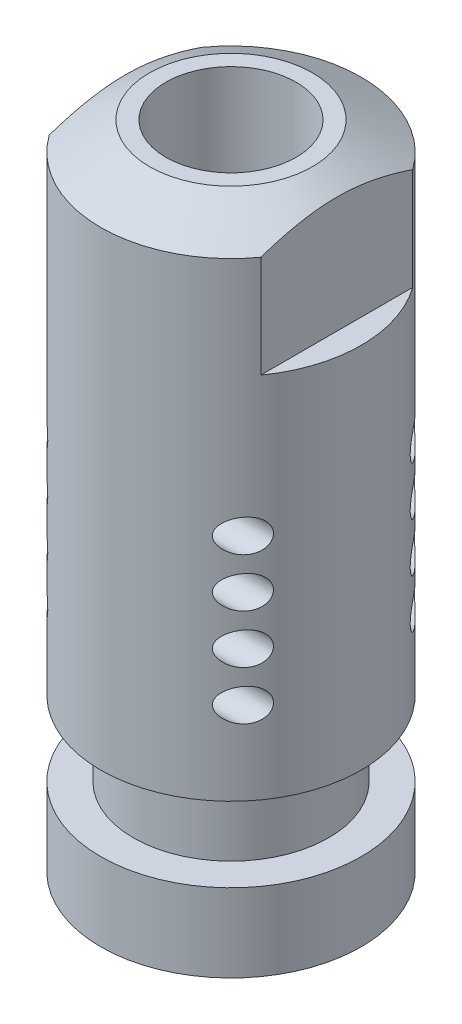
from build123d import *

# Parameters (mm, degrees)
SKETCH_1_R               = 8
EXTRUDE_1_DEPTH          = 40
CUT_EXTRUDE_START        = 4.8
SKETCH_1_3_R             = 8
SKETCH_1_3_R_2           = 6
CUT_EXTRUDE_1_DEPTH      = 4.6
CUT_EXTRUDE_START_2      = -8
CUT_EXTRUDE_2_DEPTH      = 8
SKETCH_4_3_R             = 4
CUT_EXTRUDE_3_DEPTH      = 11.5
CUT_EXTRUDE_4_DEPTH      = 42.569219382
CUT_EXTRUDE_4_DEPTH_BACK = 42.569219382
SKETCH_5_R               = 1
SKETCH_6_R               = 3.25
CUT_EXTRUDE_5_DEPTH      = 7.5


with BuildPart() as part:
    # 스케치1 → 보스-돌출1 (new body)
    with BuildSketch(Plane(origin=(0, 0, 0), x_dir=(1, 0, 0), z_dir=(0, 1, 0))):
        Circle(SKETCH_1_R)
    extrude(amount=EXTRUDE_1_DEPTH)

    # 스케치1<3> → 컷-돌출1 (cut)
    with BuildSketch(Plane(origin=(0, 0, 0), x_dir=(1, 0, 0), z_dir=(0, 1, 0)).offset(CUT_EXTRUDE_START)):
        Circle(SKETCH_1_3_R)
        Circle(SKETCH_1_3_R_2, mode=Mode.SUBTRACT)
    extrude(amount=CUT_EXTRUDE_1_DEPTH, mode=Mode.SUBTRACT)

    # 스케치3 → 컷-회전1 (revolve, cut)
    with BuildSketch(Plane(origin=(0, 0, 0), x_dir=(0, 0, -1), z_dir=(1, 0, 0))):
        Polygon((-8, 40), (-8, 38.267949192), (-5, 40), align=None)
        Polygon((8, 40), (8, 38.267949192), (5, 40), align=None)
    revolve(axis=Axis((0, 40, 0), (0, -1, 0)), mode=Mode.SUBTRACT)

    # 스케치4 → 컷-돌출2 (cut)
    with BuildSketch(Plane(origin=(0, 40, 0), x_dir=(1, 0, 0), z_dir=(0, 1, 0)).offset(CUT_EXTRUDE_START_2)):
        with BuildLine():
            Line((-6.5, -4.663689527), (-6.5, 4.663689527))
            ThreePointArc((-6.5, 4.663689527), (-8, 0), (-6.5, -4.663689527))
        make_face()
        with BuildLine():
            ThreePointArc((6.5, -4.663689527), (8, 0), (6.5, 4.663689527))
            Line((6.5, 4.663689527), (6.5, -4.663689527))
        make_face()
    extrude(amount=CUT_EXTRUDE_2_DEPTH, mode=Mode.SUBTRACT)

    # 스케치4<3> → 컷-돌출3 (cut)
    with BuildSketch(Plane(origin=(0, 40, 0), x_dir=(1, 0, 0), z_dir=(0, 1, 0))):
        Circle(SKETCH_4_3_R)
    extrude(amount=-CUT_EXTRUDE_3_DEPTH, mode=Mode.SUBTRACT)

    # 스케치5 → 컷-돌출4 (cut, two sides: drawn at the far end of the back side and taken through both)
    with BuildSketch(Plane(origin=(0, 0, 0), x_dir=(0, 0, -1), z_dir=(1, 0, 0)).offset(-CUT_EXTRUDE_4_DEPTH_BACK)):
        with Locations((-5.2, 23.5)):
            Circle(SKETCH_5_R)
        with Locations((-5.2, 20.5)):
            Circle(SKETCH_5_R)
        with Locations((-5.2, 17.5)):
            Circle(SKETCH_5_R)
        with Locations((-5.2, 14.5)):
            Circle(SKETCH_5_R)
        with Locations((5.2, 14.5)):
            Circle(SKETCH_5_R)
        with Locations((5.2, 17.5)):
            Circle(SKETCH_5_R)
        with Locations((5.2, 20.5)):
            Circle(SKETCH_5_R)
        with Locations((5.2, 23.5)):
            Circle(SKETCH_5_R)
    extrude(amount=CUT_EXTRUDE_4_DEPTH + CUT_EXTRUDE_4_DEPTH_BACK, mode=Mode.SUBTRACT)

    # 스케치6 → 컷-돌출5 (cut)
    with BuildSketch(Plane.XZ):
        Circle(SKETCH_6_R)
    extrude(amount=-CUT_EXTRUDE_5_DEPTH, mode=Mode.SUBTRACT)


solid = part.part
